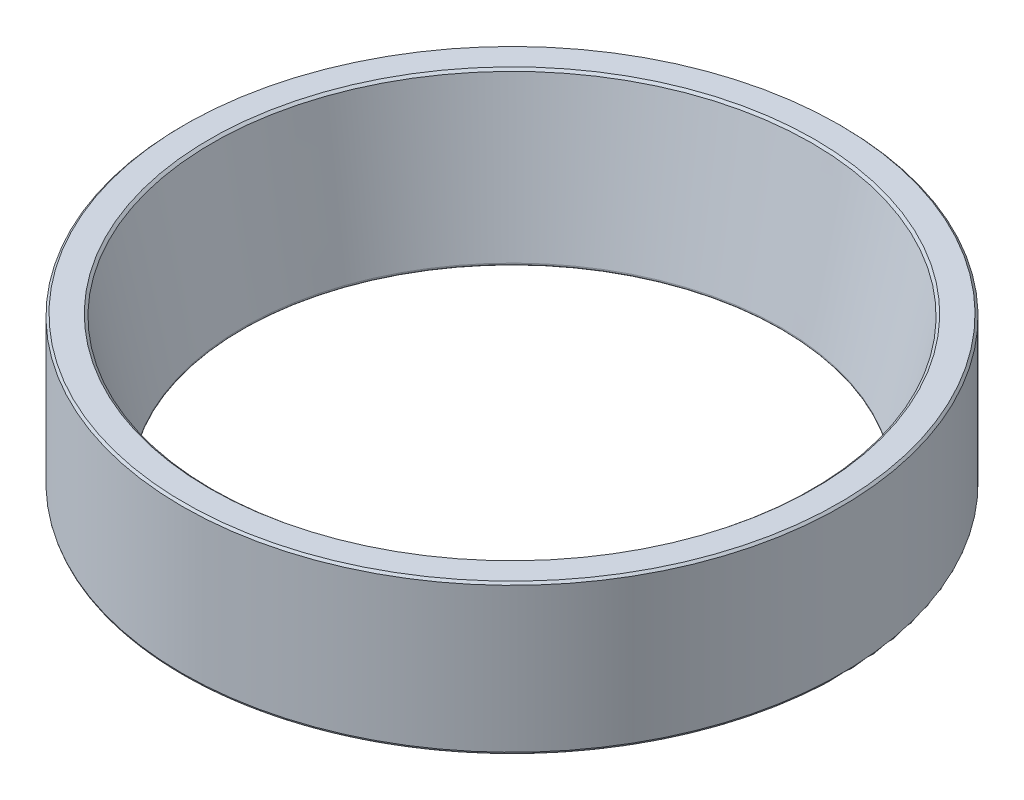
from build123d import *


with BuildPart() as part:
    # Çizim1 → Döndür1 (revolve)
    with BuildSketch(Plane.XY, mode=Mode.PRIVATE) as d_nd_r1_sk:
        with BuildLine():
            Line((-25.497397444, 0), (-30.8, 0))
            ThreePointArc((-30.8, 0), (-30.941421356, 0.058578644), (-31, 0.2))
            Line((-31, 0.2), (-31, 13.8))
            Line((-31, 13.8), (-30.8, 14))
            Line((-30.8, 14), (-28.45, 14))
            Line((-28.45, 14), (-28.208094182, 13.804439517))
            Line((-28.208094182, 13.804439517), (-25.301836961, 0.241905818))
            ThreePointArc((-25.301836961, 0.241905818), (-25.341864226, 0.074264491), (-25.497397444, 0))
        make_face()
    revolve(d_nd_r1_sk.sketch.rotate(Axis((0, 0, 0), (0, 1, 0)), 270), axis=Axis((0, 0, 0), (0, 1, 0)))


solid = part.part
